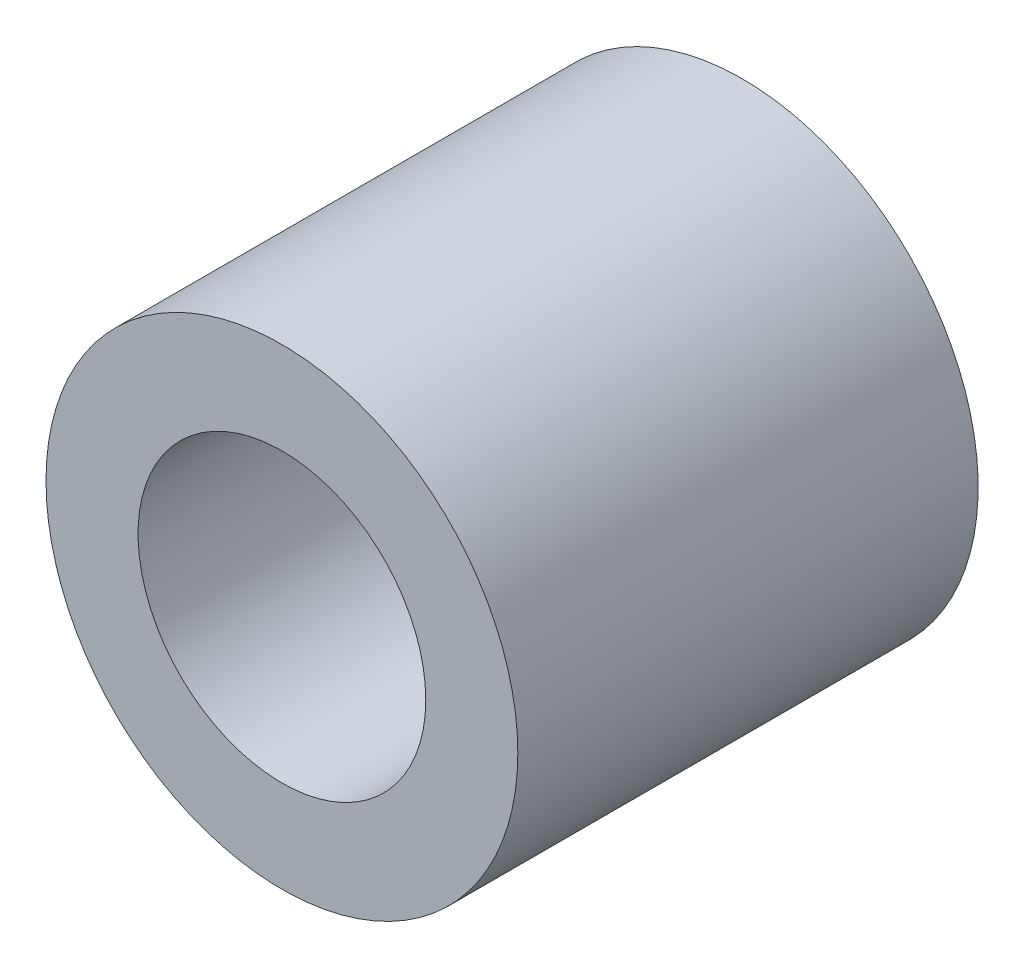
from build123d import *

# Parameters (mm, degrees)
CROQUIS1_R              = 10.25
CROQUIS1_R_2            = 6.25
SALIENTE_EXTRUIR1_DEPTH = 10
SALIENTE_EXTRUIR2_START = 10
CROQUIS2_R              = 10.25
CROQUIS2_R_2            = 4
SALIENTE_EXTRUIR2_DEPTH = 10


with BuildPart() as part:
    # Croquis1 → Saliente-Extruir1 (new body)
    with BuildSketch(Plane.XY):
        Circle(CROQUIS1_R)
        Circle(CROQUIS1_R_2, mode=Mode.SUBTRACT)
    extrude(amount=SALIENTE_EXTRUIR1_DEPTH)

    # Croquis2 → Saliente-Extruir2 (add)
    with BuildSketch(Plane(origin=(0, 0, 0), x_dir=(-1, 0, 0), z_dir=(0, 0, -1)).offset(SALIENTE_EXTRUIR2_START)):
        Circle(CROQUIS2_R)
        Circle(CROQUIS2_R_2, mode=Mode.SUBTRACT)
    extrude(amount=-SALIENTE_EXTRUIR2_DEPTH)


solid = part.part
